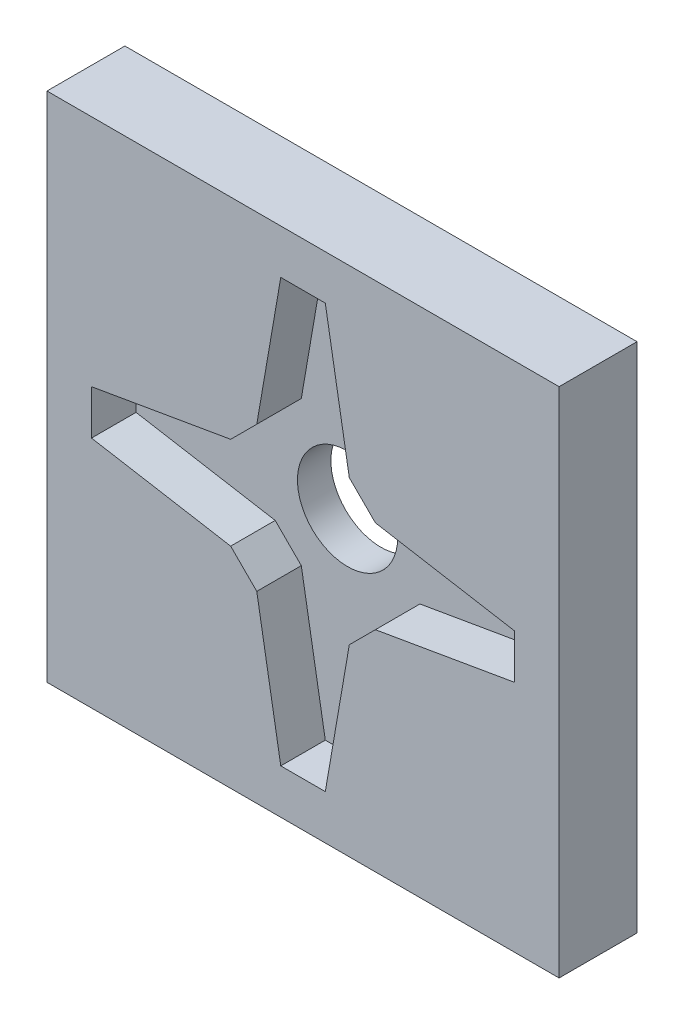
from build123d import *

# Parameters (mm, degrees)
SKETCH1_W           = 46
SKETCH1_H           = 46
BOSS_EXTRUDE1_DEPTH = 7
SKETCH2_W           = 46
SKETCH2_H           = 46
BOSS_EXTRUDE2_DEPTH = 3
SKETCH3_R           = 4.5
CUT_EXTRUDE1_DEPTH  = 3
CUT_EXTRUDE2_DEPTH  = 4


with BuildPart() as part:
    # Sketch1 → Boss-Extrude1 (new body)
    with BuildSketch(Plane.XY):
        Rectangle(SKETCH1_W, SKETCH1_H)
        Polygon((-2, 19), (2, 19), (4.5, 4.5), (19, 2), (19, -2), (4.5, -4.5), (2, -19), (-2, -19), (-4.5, -4.5), (-19, -2), (-19, 2), (-4.5, 4.5), align=None, mode=Mode.SUBTRACT)
    extrude(amount=BOSS_EXTRUDE1_DEPTH)

    # Sketch2 → Boss-Extrude2 (add)
    with BuildSketch(Plane.XY):
        Rectangle(SKETCH2_W, SKETCH2_H)
    extrude(amount=BOSS_EXTRUDE2_DEPTH)

    # Sketch3 → Cut-Extrude1 (cut)
    with BuildSketch(Plane.XY):
        Circle(SKETCH3_R)
    extrude(amount=CUT_EXTRUDE1_DEPTH, mode=Mode.SUBTRACT)

    # Sketch4 → Cut-Extrude2 (cut)
    with BuildSketch(Plane.XY.offset(7)):
        Polygon((-4.155172414, 6.5), (-6.5, 4.155172414), (-6.5, -4.155172414), (-4.155172414, -6.5), (4.155172414, -6.5), (6.5, -4.155172414), (6.5, 4.155172414), (4.155172414, 6.5), align=None)
    extrude(amount=-CUT_EXTRUDE2_DEPTH, mode=Mode.SUBTRACT)


solid = part.part
